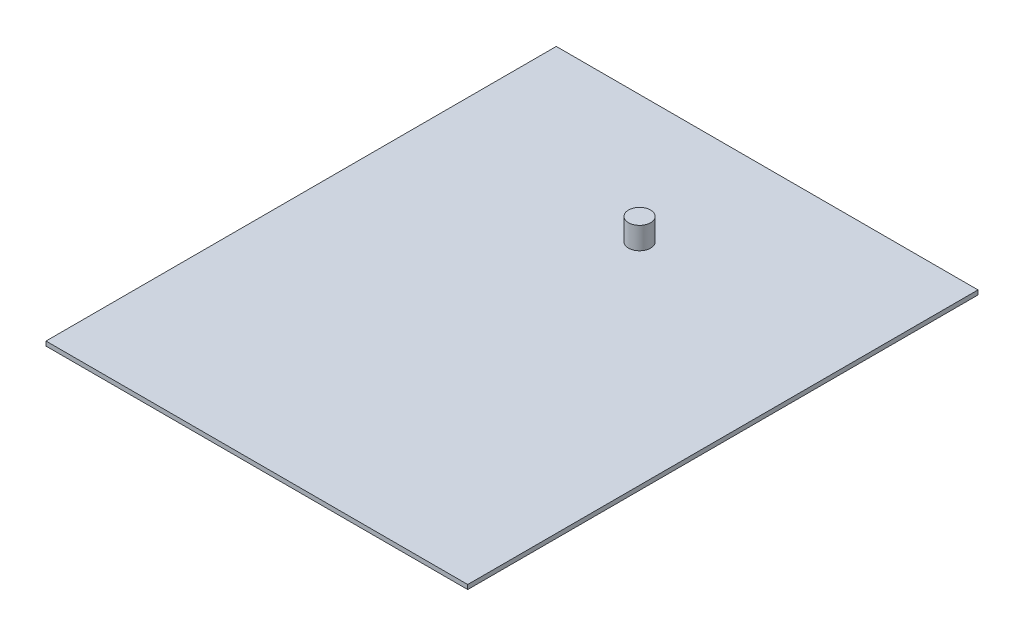
from build123d import *

# Parameters (mm, degrees)
SKETCH_1_W      = 191.4
SKETCH_1_H      = 231.6
EXTRUDE_1_DEPTH = 2
SKETCH_2_R      = 5
EXTRUDE_2_DEPTH = 10


with BuildPart() as part:
    # 草图1 → 凸台-拉伸1 (new body)
    with BuildSketch(Plane(origin=(0, 0, 0), x_dir=(1, 0, 0), z_dir=(0, 1, 0))):
        Rectangle(SKETCH_1_W, SKETCH_1_H)
    extrude(amount=EXTRUDE_1_DEPTH)

    # 草图2 → 凸台-拉伸2 (add)
    with BuildSketch(Plane(origin=(0, 2, 0), x_dir=(1, 0, 0), z_dir=(0, 1, 0))):
        with Locations(Location((0, 57.9, 0), (0, 0, 90))):
            Circle(SKETCH_2_R)
    extrude(amount=EXTRUDE_2_DEPTH)


solid = part.part
